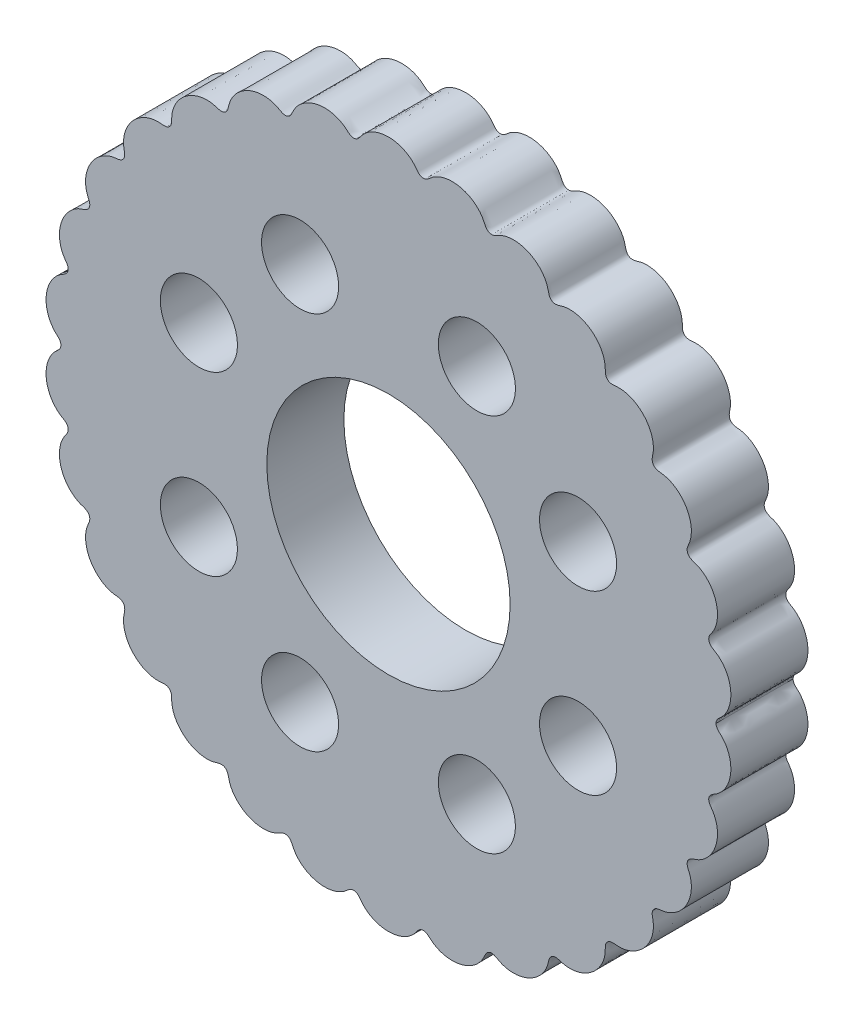
from build123d import *

# Parameters (mm, degrees)
BOSS_EXTRU_1_DEPTH      = 7
ESQUISSE2_R             = 3.5
ESQUISSE2_R_2           = 11.05
ENL_V_MAT_EXTRU_1_DEPTH = 45.638751691


with BuildPart() as part:
    # Esquisse1 → Boss.-Extru.1 (new body)
    with BuildSketch(Plane.XY):
        with BuildLine():
            add(Edge.make_bspline(
                [(29.75, 0), (29.75, -0.140597317), (29.868141552, -0.421461557), (30.323728325, -0.778551317), (30.756059113, -1.360631901), (31.05528351, -2.175436877), (31.1311911, -3.039210716), (30.990585079, -3.894473922), (30.697291766, -4.555148986), (30.36186421, -5.022144822), (30.060775877, -5.330577748), (29.717846033, -5.592712113), (29.328538855, -5.782182254), (29.049792204, -6.141427792), (29.111562517, -6.597079384), (29.389901644, -6.932142165), (29.605756987, -7.304556503), (29.763326521, -7.706225348), (29.890581441, -8.266803983), (29.902367273, -8.989748333), (29.697008207, -9.831679599), (29.289195496, -10.597300184), (28.696108316, -11.229222627), (28.071702237, -11.603099513), (27.513860316, -11.745290086), (27.153595417, -12.01834534), (27.094633413, -12.476886731), (27.294073027, -12.865586826), (27.433341475, -13.272169368), (27.532867261, -13.83914708), (27.496449686, -14.561800198), (27.228816643, -15.386455528), (26.764531631, -16.118443702), (26.236468325, -16.61186626), (25.745602358, -16.911413725), (25.348623221, -17.078579019), (24.930243872, -17.188384684), (24.500217935, -17.207149826), (24.083804251, -17.377842841), (23.906848881, -17.807350624), (24.015247501, -18.231768991), (24.073447524, -18.656891554), (24.062056853, -19.08873021), (23.961398047, -19.654539591), (23.689675117, -20.32471612), (23.171173996, -21.019306273), (22.608883954, -21.47280356), (22.099971556, -21.74022471), (21.559984305, -21.93443999), (20.982281642, -22.017883352), (20.416041208, -21.930735471), (19.972021705, -21.988439699), (19.688462786, -22.358972522), (19.69790625, -22.798005124), (19.673174245, -23.225799304), (19.543724586, -23.787387211), (19.229151848, -24.438621475), (18.660017359, -25.093061515), (17.946397928, -25.584588147), (17.131418747, -25.882955741), (16.410791008, -25.938043434), (15.839458095, -25.855825215), (15.437343422, -25.707694829), (14.994659593, -25.651417476), (14.623488937, -25.936605654), (14.530838201, -26.366842479), (14.424788701, -26.78151288), (14.245602688, -27.175160055), (13.933225228, -27.657279928), (13.42101245, -28.168198322), (12.672236724, -28.604290578), (11.837778732, -28.841668679), (10.972095571, -28.855360209), (10.266577085, -28.66935197), (9.778355486, -28.372966253), (9.365747914, -28.207683461), (8.932323413, -28.387404231), (8.740197599, -28.784607909), (8.556885887, -29.170933655), (8.218275705, -29.63802323), (7.675546763, -30.115566718), (6.895499115, -30.495235047), (6.046463762, -30.668270941), (5.179841061, -30.624062878), (4.494438496, -30.394918661), (4.000166127, -30.096703374), (3.68505546, -29.807717775), (3.326944679, -29.546190998), (2.861199415, -29.607519812), (2.579043887, -29.947765715), (2.239300608, -30.40625765), (1.663361794, -30.853093305), (0.860435788, -31.177849944), (3.305e-06, -31.28607424), (-0.860438264, -31.177852117), (-1.663337129, -30.853084694), (-2.239345562, -30.406277477), (-2.578974817, -29.947730674), (-2.861199778, -29.607527006), (-3.326939684, -29.546188057), (-3.685051978, -29.807717556), (-4.000165501, -30.096703111), (-4.494438307, -30.394918698), (-5.17984122, -30.624062885), (-6.046463749, -30.668270945), (-6.895499126, -30.495235047), (-7.675546761, -30.115566719), (-8.218275704, -29.638023229), (-8.556885888, -29.170933655), (-8.740197599, -28.784607909), (-8.932323413, -28.387404231), (-9.365747914, -28.207683461), (-9.778355486, -28.372966253), (-10.266577085, -28.66935197), (-10.972095571, -28.855360209), (-11.837778732, -28.841668678), (-12.672236724, -28.604290578), (-13.42101245, -28.168198322), (-13.933225228, -27.657279928), (-14.245602688, -27.175160055), (-14.424788701, -26.78151288), (-14.530838201, -26.366842479), (-14.623488937, -25.936605654), (-14.994659593, -25.651417476), (-15.437343422, -25.707694829), (-15.839458095, -25.855825215), (-16.410791008, -25.938043434), (-17.131418747, -25.882955741), (-17.946397928, -25.584588147), (-18.660017359, -25.093061515), (-19.229151848, -24.438621475), (-19.543724586, -23.787387211), (-19.673174245, -23.225799304), (-19.69790625, -22.798005124), (-19.688462786, -22.358972522), (-19.972021705, -21.988439699), (-20.416041208, -21.930735471), (-20.982281642, -22.017883352), (-21.559984305, -21.93443999), (-22.099971556, -21.74022471), (-22.608883954, -21.47280356), (-23.171173996, -21.019306273), (-23.689675117, -20.32471612), (-23.961398047, -19.654539591), (-24.062056853, -19.08873021), (-24.073447524, -18.656891554), (-24.015247501, -18.231768991), (-23.906848881, -17.807350624), (-24.083804251, -17.377842841), (-24.500217935, -17.207149826), (-24.930243872, -17.188384684), (-25.348623221, -17.078579019), (-25.745602358, -16.911413725), (-26.236468325, -16.61186626), (-26.764531631, -16.118443702), (-27.228816643, -15.386455528), (-27.496449686, -14.561800198), (-27.532867261, -13.83914708), (-27.433341475, -13.272169368), (-27.294073027, -12.865586826), (-27.094633413, -12.476886731), (-27.153595417, -12.01834534), (-27.513860316, -11.745290086), (-28.071702237, -11.603099513), (-28.696108316, -11.229222627), (-29.289195496, -10.597300184), (-29.697008207, -9.831679599), (-29.902367273, -8.989748333), (-29.890581441, -8.266803983), (-29.763326521, -7.706225348), (-29.605756987, -7.304556503), (-29.389901644, -6.932142165), (-29.111562517, -6.597079384), (-29.049792204, -6.141427792), (-29.328538855, -5.782182254), (-29.717846035, -5.592712108), (-30.060775874, -5.330577753), (-30.361864232, -5.022144787), (-30.697291735, -4.555149037), (-30.990585034, -3.894473995), (-31.131191105, -3.039210707), (-31.05528297, -2.175437752), (-30.756059941, -1.360630553), (-30.32372715, -0.778553246), (-29.868141764, -0.421461177), (-29.75, -0.140597316), (-29.75, 0)],
                knots=[0.074015259, 0.074015259, 0.074015259, 0.074015259, 0.077343265, 0.080671271, 0.087327283, 0.093983294, 0.100639306, 0.107295317, 0.113951329, 0.117279335, 0.12060734, 0.123935346, 0.127263352, 0.130591358, 0.133919364, 0.137247369, 0.140575375, 0.143903381, 0.147231387, 0.153887398, 0.16054341, 0.167199421, 0.173855433, 0.180511445, 0.18383945, 0.187167456, 0.190495462, 0.193823468, 0.197151474, 0.200479479, 0.207135491, 0.213791502, 0.220447514, 0.227103526, 0.230431531, 0.233759537, 0.237087543, 0.240415549, 0.243743555, 0.24707156, 0.250399566, 0.253727572, 0.257055578, 0.260383583, 0.267039595, 0.273695607, 0.280351618, 0.283679624, 0.28700763, 0.293663641, 0.296991647, 0.300319653, 0.303647659, 0.306975664, 0.31030367, 0.313631676, 0.320287688, 0.326943699, 0.333599711, 0.340255722, 0.346911734, 0.35023974, 0.353567745, 0.356895751, 0.360223757, 0.363551763, 0.366879769, 0.370207774, 0.37353578, 0.380191792, 0.386847803, 0.393503815, 0.400159826, 0.406815838, 0.410143844, 0.41347185, 0.416799855, 0.420127861, 0.423455867, 0.426783873, 0.433439884, 0.440095896, 0.446751907, 0.453407919, 0.460063931, 0.463391936, 0.466719942, 0.470047948, 0.473375954, 0.47670396, 0.480031965, 0.486687977, 0.493343988, 0.5, 0.506656012, 0.513312023, 0.519968035, 0.52329604, 0.526624046, 0.529952052, 0.533280058, 0.536608064, 0.539936069, 0.546592081, 0.553248093, 0.559904104, 0.566560116, 0.573216127, 0.576544133, 0.579872139, 0.583200145, 0.58652815, 0.589856156, 0.593184162, 0.599840174, 0.606496185, 0.613152197, 0.619808208, 0.62646422, 0.629792226, 0.633120231, 0.636448237, 0.639776243, 0.643104249, 0.646432255, 0.64976026, 0.653088266, 0.659744278, 0.666400289, 0.673056301, 0.679712312, 0.686368324, 0.68969633, 0.693024336, 0.696352341, 0.699680347, 0.703008353, 0.706336359, 0.71299237, 0.716320376, 0.719648382, 0.726304393, 0.732960405, 0.739616417, 0.742944422, 0.746272428, 0.749600434, 0.75292844, 0.756256445, 0.759584451, 0.762912457, 0.766240463, 0.769568469, 0.772896474, 0.779552486, 0.786208498, 0.792864509, 0.799520521, 0.802848526, 0.806176532, 0.809504538, 0.812832544, 0.81616055, 0.819488555, 0.826144567, 0.832800579, 0.83945659, 0.846112602, 0.852768613, 0.856096619, 0.859424625, 0.862752631, 0.866080636, 0.869408642, 0.872736648, 0.876064654, 0.87939266, 0.882720665, 0.886048671, 0.892704683, 0.899360694, 0.906016706, 0.912672717, 0.919328729, 0.922656735, 0.925984741, 0.925984741, 0.925984741, 0.925984741], degree=3))
            add(Edge.make_bspline(
                [(-29.75, 0), (-29.75, 0.140597316), (-29.868141764, 0.421461177), (-30.32372715, 0.778553246), (-30.756059941, 1.360630553), (-31.05528297, 2.175437752), (-31.131191105, 3.039210707), (-30.990585034, 3.894473995), (-30.697291735, 4.555149037), (-30.361864232, 5.022144787), (-30.060775874, 5.330577753), (-29.717846035, 5.592712108), (-29.328538855, 5.782182254), (-29.049792204, 6.141427792), (-29.111562517, 6.597079384), (-29.389901644, 6.932142165), (-29.605756987, 7.304556503), (-29.763326521, 7.706225348), (-29.890581441, 8.266803983), (-29.902367273, 8.989748333), (-29.697008207, 9.831679599), (-29.289195496, 10.597300184), (-28.696108316, 11.229222627), (-28.071702237, 11.603099513), (-27.513860316, 11.745290086), (-27.153595417, 12.01834534), (-27.094633413, 12.476886731), (-27.294073027, 12.865586826), (-27.433341475, 13.272169368), (-27.532867261, 13.83914708), (-27.496449686, 14.561800198), (-27.228816643, 15.386455528), (-26.764531631, 16.118443702), (-26.236468325, 16.61186626), (-25.745602358, 16.911413725), (-25.348623221, 17.078579019), (-24.930243872, 17.188384684), (-24.500217935, 17.207149826), (-24.083804251, 17.377842841), (-23.906848881, 17.807350624), (-24.015247501, 18.231768991), (-24.073447524, 18.656891554), (-24.062056853, 19.08873021), (-23.961398047, 19.654539591), (-23.689675117, 20.32471612), (-23.171173996, 21.019306273), (-22.608883954, 21.47280356), (-22.099971556, 21.74022471), (-21.559984305, 21.93443999), (-20.982281642, 22.017883352), (-20.416041208, 21.930735471), (-19.972021705, 21.988439699), (-19.688462786, 22.358972522), (-19.69790625, 22.798005124), (-19.673174245, 23.225799304), (-19.543724586, 23.787387211), (-19.229151848, 24.438621475), (-18.660017359, 25.093061515), (-17.946397928, 25.584588147), (-17.131418747, 25.882955741), (-16.410791008, 25.938043434), (-15.839458095, 25.855825215), (-15.437343422, 25.707694829), (-14.994659593, 25.651417476), (-14.623488937, 25.936605654), (-14.530838201, 26.366842479), (-14.424788701, 26.78151288), (-14.245602688, 27.175160055), (-13.933225228, 27.657279928), (-13.42101245, 28.168198322), (-12.672236724, 28.604290578), (-11.837778732, 28.841668678), (-10.972095571, 28.855360209), (-10.266577085, 28.669351969), (-9.778355486, 28.372966253), (-9.365747914, 28.207683461), (-8.932323413, 28.387404231), (-8.740197599, 28.784607909), (-8.556885888, 29.170933655), (-8.218275704, 29.638023229), (-7.675546761, 30.115566719), (-6.895499126, 30.495235047), (-6.046463749, 30.668270945), (-5.17984122, 30.624062885), (-4.494438307, 30.394918698), (-4.000165501, 30.096703111), (-3.685051978, 29.807717556), (-3.326939684, 29.546188057), (-2.861199778, 29.607527006), (-2.578974817, 29.947730674), (-2.239345562, 30.406277477), (-1.663337129, 30.853084694), (-0.860438264, 31.177852117), (3.305e-06, 31.28607424), (0.860435788, 31.177849944), (1.663361794, 30.853093305), (2.239300608, 30.40625765), (2.579043887, 29.947765715), (2.861199415, 29.607519812), (3.326944679, 29.546190998), (3.68505546, 29.807717775), (4.000166127, 30.096703374), (4.494438496, 30.394918661), (5.179841061, 30.624062878), (6.046463762, 30.668270941), (6.895499115, 30.495235047), (7.675546763, 30.115566718), (8.218275705, 29.63802323), (8.556885887, 29.170933655), (8.740197599, 28.784607909), (8.932323413, 28.387404231), (9.365747914, 28.207683461), (9.778355486, 28.372966253), (10.266577085, 28.66935197), (10.972095571, 28.855360209), (11.837778732, 28.841668678), (12.672236724, 28.604290578), (13.42101245, 28.168198322), (13.933225228, 27.657279928), (14.245602688, 27.175160055), (14.424788701, 26.78151288), (14.530838201, 26.366842479), (14.623488937, 25.936605654), (14.994659593, 25.651417476), (15.437343422, 25.707694829), (15.839458095, 25.855825215), (16.410791008, 25.938043434), (17.131418747, 25.882955741), (17.946397928, 25.584588147), (18.660017359, 25.093061515), (19.229151848, 24.438621475), (19.543724586, 23.787387211), (19.673174245, 23.225799304), (19.69790625, 22.798005124), (19.688462786, 22.358972522), (19.972021705, 21.988439699), (20.416041208, 21.930735471), (20.982281642, 22.017883352), (21.559984305, 21.93443999), (22.099971556, 21.74022471), (22.608883954, 21.47280356), (23.171173996, 21.019306273), (23.689675117, 20.32471612), (23.961398047, 19.654539591), (24.062056853, 19.08873021), (24.073447524, 18.656891554), (24.015247501, 18.231768991), (23.906848881, 17.807350624), (24.083804251, 17.377842841), (24.500217935, 17.207149826), (24.930243872, 17.188384684), (25.348623221, 17.078579019), (25.745602358, 16.911413725), (26.236468325, 16.61186626), (26.764531631, 16.118443702), (27.228816643, 15.386455528), (27.496449686, 14.561800198), (27.532867261, 13.83914708), (27.433341475, 13.272169368), (27.294073027, 12.865586826), (27.094633413, 12.476886731), (27.153595417, 12.01834534), (27.513860316, 11.745290086), (28.071702237, 11.603099513), (28.696108316, 11.229222627), (29.289195496, 10.597300184), (29.697008207, 9.831679599), (29.902367273, 8.989748333), (29.890581441, 8.266803983), (29.763326521, 7.706225348), (29.605756987, 7.304556503), (29.389901644, 6.932142165), (29.111562517, 6.597079384), (29.049792204, 6.141427792), (29.328538855, 5.782182254), (29.717846033, 5.592712113), (30.060775877, 5.330577748), (30.36186421, 5.022144822), (30.697291766, 4.555148986), (30.990585079, 3.894473922), (31.1311911, 3.039210716), (31.05528351, 2.175436877), (30.756059113, 1.360631901), (30.323728325, 0.778551317), (29.868141552, 0.421461557), (29.75, 0.140597317), (29.75, 0)],
                knots=[0.074015259, 0.074015259, 0.074015259, 0.074015259, 0.077343265, 0.080671271, 0.087327283, 0.093983294, 0.100639306, 0.107295317, 0.113951329, 0.117279335, 0.12060734, 0.123935346, 0.127263352, 0.130591358, 0.133919364, 0.137247369, 0.140575375, 0.143903381, 0.147231387, 0.153887398, 0.16054341, 0.167199421, 0.173855433, 0.180511445, 0.18383945, 0.187167456, 0.190495462, 0.193823468, 0.197151474, 0.200479479, 0.207135491, 0.213791502, 0.220447514, 0.227103526, 0.230431531, 0.233759537, 0.237087543, 0.240415549, 0.243743555, 0.24707156, 0.250399566, 0.253727572, 0.257055578, 0.260383583, 0.267039595, 0.273695607, 0.280351618, 0.283679624, 0.28700763, 0.293663641, 0.296991647, 0.300319653, 0.303647659, 0.306975664, 0.31030367, 0.313631676, 0.320287688, 0.326943699, 0.333599711, 0.340255722, 0.346911734, 0.35023974, 0.353567745, 0.356895751, 0.360223757, 0.363551763, 0.366879769, 0.370207774, 0.37353578, 0.380191792, 0.386847803, 0.393503815, 0.400159826, 0.406815838, 0.410143844, 0.41347185, 0.416799855, 0.420127861, 0.423455867, 0.426783873, 0.433439884, 0.440095896, 0.446751907, 0.453407919, 0.460063931, 0.463391936, 0.466719942, 0.470047948, 0.473375954, 0.47670396, 0.480031965, 0.486687977, 0.493343988, 0.5, 0.506656012, 0.513312023, 0.519968035, 0.52329604, 0.526624046, 0.529952052, 0.533280058, 0.536608064, 0.539936069, 0.546592081, 0.553248093, 0.559904104, 0.566560116, 0.573216127, 0.576544133, 0.579872139, 0.583200145, 0.58652815, 0.589856156, 0.593184162, 0.599840174, 0.606496185, 0.613152197, 0.619808208, 0.62646422, 0.629792226, 0.633120231, 0.636448237, 0.639776243, 0.643104249, 0.646432255, 0.64976026, 0.653088266, 0.659744278, 0.666400289, 0.673056301, 0.679712312, 0.686368324, 0.68969633, 0.693024336, 0.696352341, 0.699680347, 0.703008353, 0.706336359, 0.71299237, 0.716320376, 0.719648382, 0.726304393, 0.732960405, 0.739616417, 0.742944422, 0.746272428, 0.749600434, 0.75292844, 0.756256445, 0.759584451, 0.762912457, 0.766240463, 0.769568469, 0.772896474, 0.779552486, 0.786208498, 0.792864509, 0.799520521, 0.802848526, 0.806176532, 0.809504538, 0.812832544, 0.81616055, 0.819488555, 0.826144567, 0.832800579, 0.83945659, 0.846112602, 0.852768613, 0.856096619, 0.859424625, 0.862752631, 0.866080636, 0.869408642, 0.872736648, 0.876064654, 0.87939266, 0.882720665, 0.886048671, 0.892704683, 0.899360694, 0.906016706, 0.912672717, 0.919328729, 0.922656735, 0.925984741, 0.925984741, 0.925984741, 0.925984741], degree=3))
        make_face()
    extrude(amount=BOSS_EXTRU_1_DEPTH)

    # Esquisse2 → Enlèv. mat.-Extru.1 (cut, through all)
    with BuildSketch(Plane.XY.offset(7)):
        with Locations((-8.029746973, 17.219847954)):
            Circle(ESQUISSE2_R)
        with Locations(Location((8.029746973, 17.219847954, 0), (0, 0, 180))):
            Circle(ESQUISSE2_R)
        with Locations((17.219847954, 8.029746973)):
            Circle(ESQUISSE2_R)
        with Locations(Location((17.219847954, -8.029746973, 0), (0, 0, 180))):
            Circle(ESQUISSE2_R)
        with Locations((8.029746973, -17.219847954)):
            Circle(ESQUISSE2_R)
        with Locations(Location((-8.029746973, -17.219847954, 0), (0, 0, 180))):
            Circle(ESQUISSE2_R)
        with Locations((-17.219847954, -8.029746973)):
            Circle(ESQUISSE2_R)
        with Locations(Location((-17.219847954, 8.029746973, 0), (0, 0, 180))):
            Circle(ESQUISSE2_R)
        Circle(ESQUISSE2_R_2)
    extrude(amount=-ENL_V_MAT_EXTRU_1_DEPTH, mode=Mode.SUBTRACT)


solid = part.part
